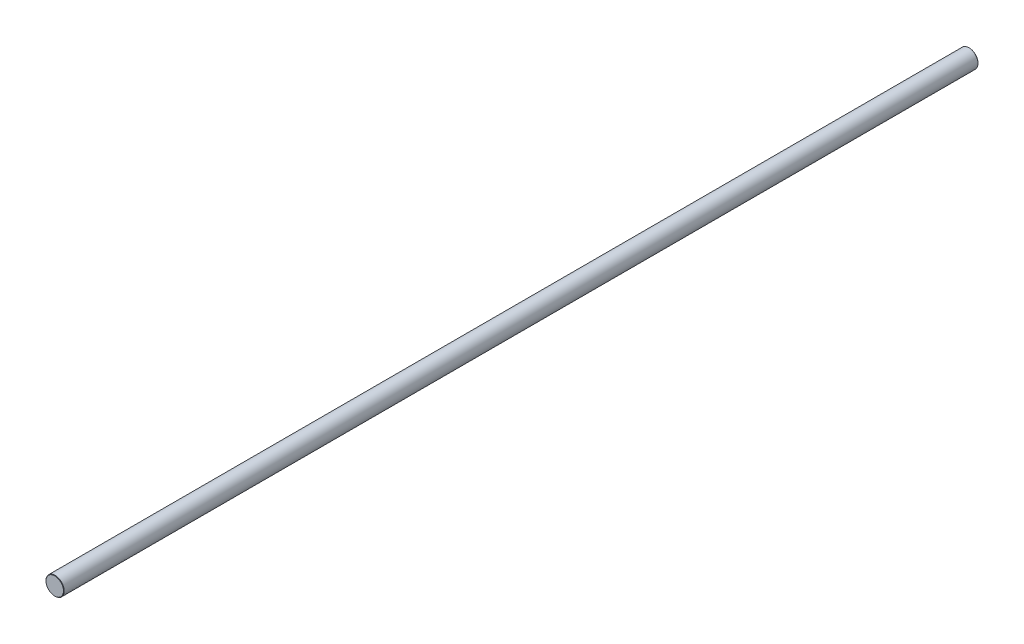
from build123d import *

# Parameters (mm, degrees)
SKETCH1_R           = 12.7
BOSS_EXTRUDE1_DEPTH = 1276
CHAMFER1_SIZE       = 0.5


with BuildPart() as part:
    # Sketch1 → Boss-Extrude1 (new body)
    with BuildSketch(Plane.XY):
        Circle(SKETCH1_R)
    extrude(amount=BOSS_EXTRUDE1_DEPTH)

    # Chamfer1
    chamfer1_edges = [part.edges().sort_by_distance(p)[0] for p in [
        (-12.7, 0, 0),
        (-12.7, 0, 1276),
    ]]
    chamfer(chamfer1_edges, length=CHAMFER1_SIZE)


solid = part.part
